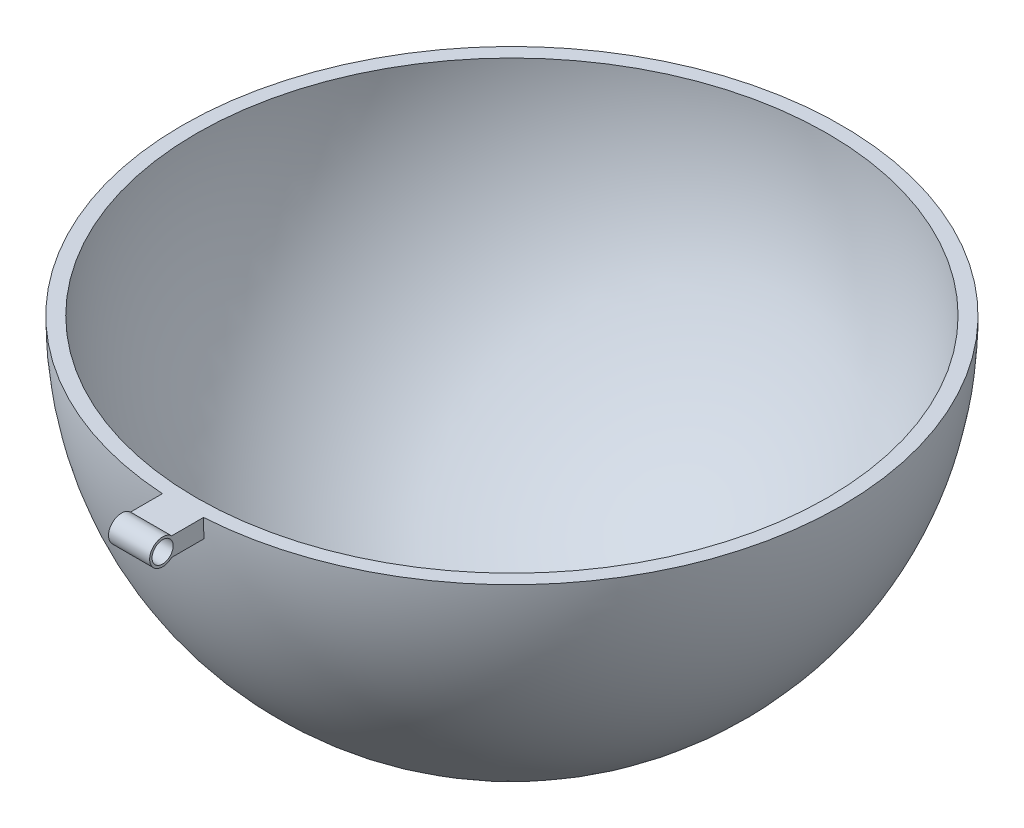
from build123d import *

# Parameters (mm, degrees)
REVOLVE1_ANGLE      = 180
SKETCH2_R           = 2.54
BOSS_EXTRUDE1_DEPTH = 4.953


with BuildPart() as part:
    # Sketch1 → Revolve1 (revolve)
    with BuildSketch(Plane(origin=(0, 0, 0), x_dir=(1, 0, 0), z_dir=(0, 1, 0))):
        with BuildLine():
            Line((-79.375, 0), (-75.977597345, 0))
            ThreePointArc((-75.977597345, 0), (0, -75.977597345), (75.977597345, 0))
            Line((75.977597345, 0), (79.375, 0))
            ThreePointArc((79.375, 0), (0, -79.375), (-79.375, 0))
        make_face()
    revolve(axis=Axis((-79.375, 0, 0), (1, 0, 0)), revolution_arc=REVOLVE1_ANGLE)

    # Sketch2 → Boss-Extrude1 (add, symmetric)
    with BuildSketch(Plane(origin=(0, 0, 0), x_dir=(0, 0, -1), z_dir=(1, 0, 0))):
        with BuildLine():
            Line((-75.977597345, 0), (-86.899597345, 0))
            ThreePointArc((-86.899597345, 0), (-92.195416839, -2.254183903), (-86.899597345, -4.508367806))
            Line((-86.899597345, -4.508367806), (-75.977597345, -4.508367806))
            Line((-75.977597345, -4.508367806), (-75.977597345, 0))
        make_face()
        with Locations((-89.067756501, -2.254183903)):
            Circle(SKETCH2_R, mode=Mode.SUBTRACT)
    extrude(amount=BOSS_EXTRUDE1_DEPTH, both=True)


solid = part.part
